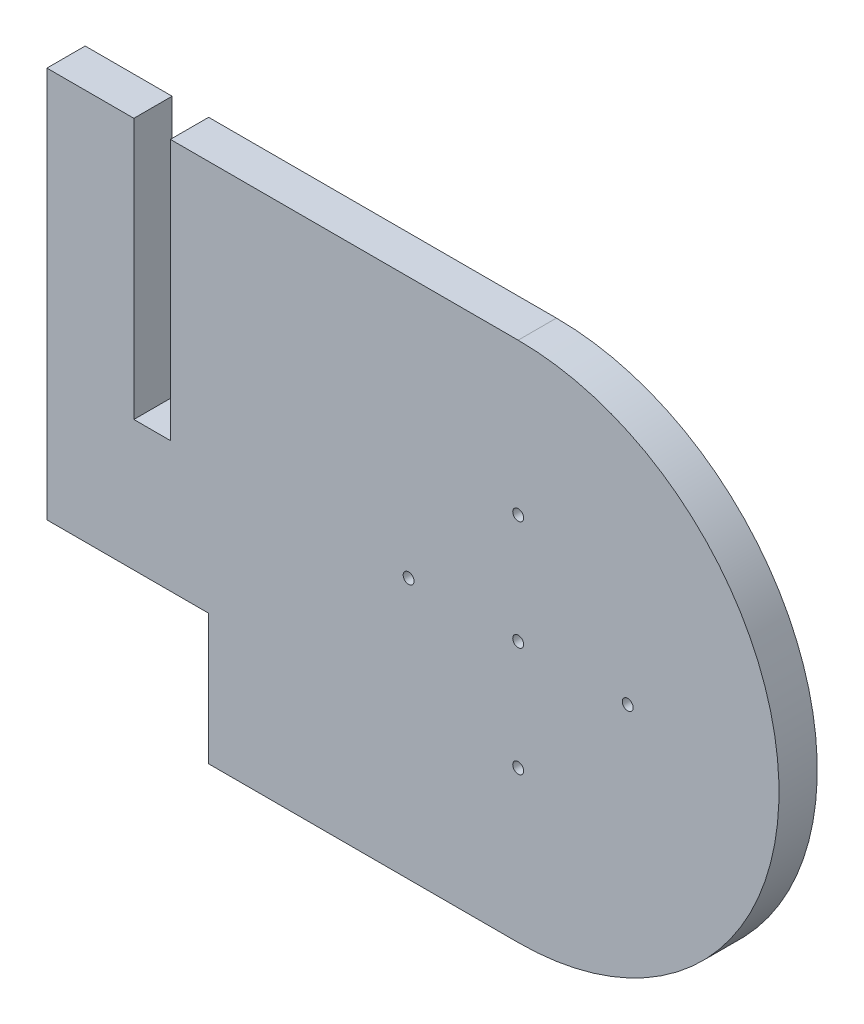
from build123d import *

# Parameters (mm, degrees)
SKETCH1_R           = 0.396875
BOSS_EXTRUDE1_DEPTH = 2.794


with BuildPart() as part:
    # Sketch1 → Boss-Extrude1 (new body)
    with BuildSketch(Plane.XY):
        with BuildLine():
            Line((-6.728072382, 19.05), (18.671927618, 19.05))
            ThreePointArc((18.671927618, 19.05), (37.721927618, 0), (18.671927618, -19.05))
            Line((18.671927618, -19.05), (-3.934072382, -19.05))
            Line((-3.934072382, -19.05), (-3.934072382, -9.525))
            Line((-3.934072382, -9.525), (-15.745072382, -9.525))
            Line((-15.745072382, -9.525), (-15.745072382, 19.05))
            Line((-15.745072382, 19.05), (-9.395072382, 19.05))
            Line((-9.395072382, 19.05), (-9.395072382, 0))
            Line((-9.395072382, 0), (-6.728072382, 0))
            Line((-6.728072382, 0), (-6.728072382, 19.05))
        make_face()
        with Locations((18.671927618, 8)):
            Circle(SKETCH1_R, mode=Mode.SUBTRACT)
        with Locations((18.671927618, 0)):
            Circle(SKETCH1_R, mode=Mode.SUBTRACT)
        with Locations((26.671927618, 0)):
            Circle(SKETCH1_R, mode=Mode.SUBTRACT)
        with Locations((18.671927618, -8)):
            Circle(SKETCH1_R, mode=Mode.SUBTRACT)
        with Locations((10.671927618, 0)):
            Circle(SKETCH1_R, mode=Mode.SUBTRACT)
    extrude(amount=BOSS_EXTRUDE1_DEPTH)


solid = part.part
